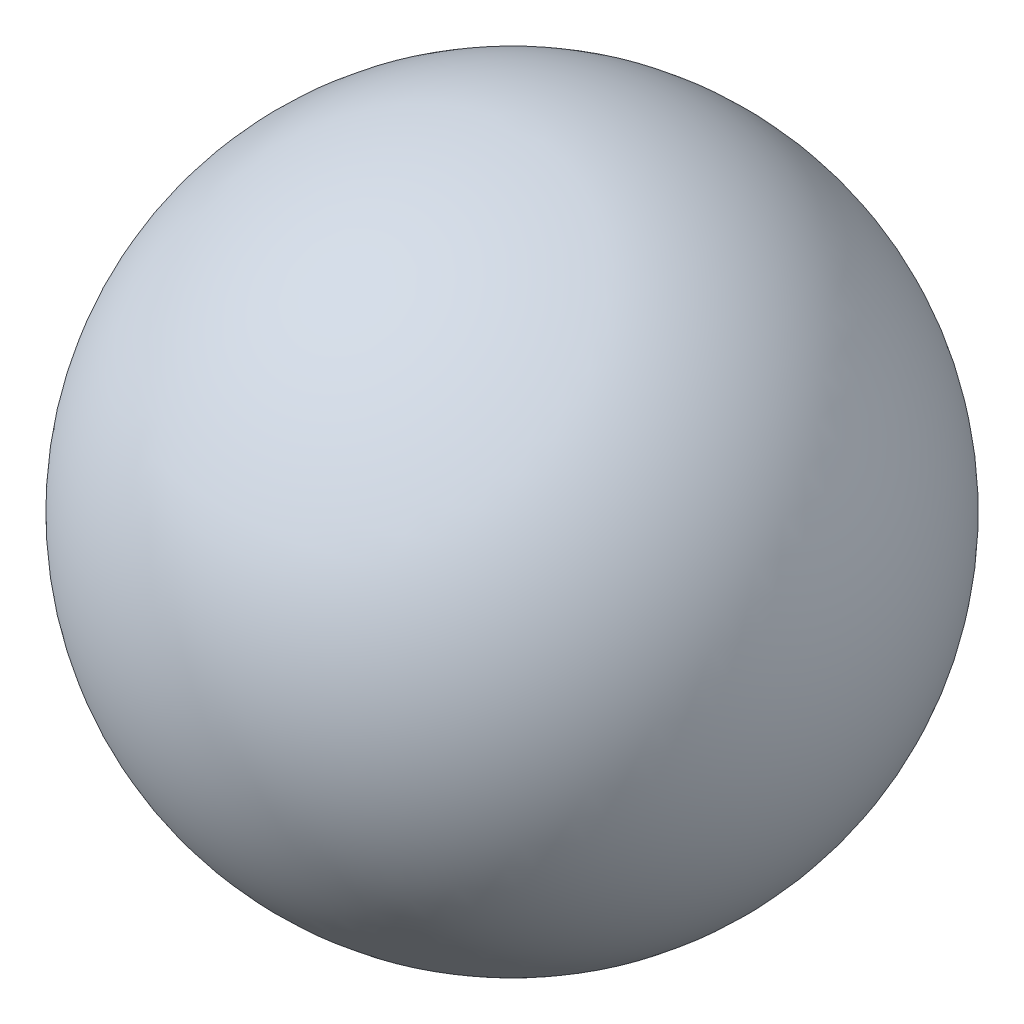
from build123d import *

# Parameters (mm, degrees)
SCALE1_SCALE = 0.5


with BuildPart() as part:
    # Sketch1 → Revolve1 (revolve)
    with BuildSketch(Plane.XY):
        with BuildLine():
            Line((-8.048368732, 79.366975769), (-8.048368732, -23.028394644))
            ThreePointArc((-8.048368732, -23.028394644), (43.149316474, 28.169290562), (-8.048368732, 79.366975769))
        make_face()
    revolve(axis=Axis((-8.048368732, 79.366975769, 0), (0, -1, 0)))


with BuildPart() as part_1:
    # Scale1: scaled about (-8.048368732, 28.169290562, 0)
    add(part.part.scale(SCALE1_SCALE).moved(Location((-4.024184366, 14.084645281, 0))))


solid = part_1.part
